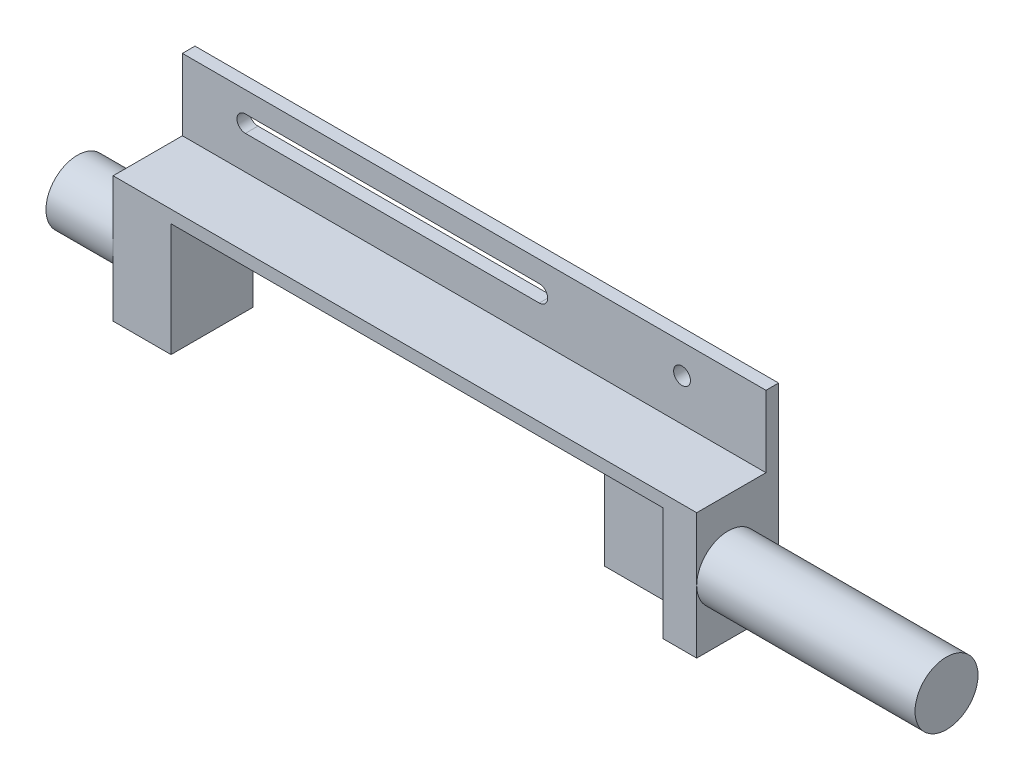
from build123d import *

# Parameters (mm, degrees)
BOSS_EXTRUDE1_DEPTH     = 139
SKETCH3_R               = 2
CUT_EXTRUDE1_DEPTH      = 153.647469681
SKETCH5_W               = 30
SKETCH5_H               = 60
BOSS_EXTRUDE2_DEPTH     = 13.7
SKETCH6_W               = 27.582278357
SKETCH6_H               = 4.25
SKETCH6_W_2             = 27.382278357
BOSS_EXTRUDE3_DEPTH     = 10
CUT_EXTRUDE3_DEPTH      = 132.062650228
CUT_EXTRUDE3_DEPTH_BACK = 132.062650228
SKETCH7_R               = 1
SKETCH4_R               = 7.5
BOSS_EXTRUDE4_DEPTH     = 52
BOSS_EXTRUDE5_START     = -155
SKETCH4_2_R             = 7.5
BOSS_EXTRUDE5_DEPTH     = 155
SKETCH8_W               = 30
SKETCH8_H               = 13.7
CUT_EXTRUDE4_DEPTH      = 18.85
SKETCH9_W               = 95.207004137
SKETCH9_H               = 27
CUT_EXTRUDE5_DEPTH      = 202.60032242
SKETCH10_W              = 139
SKETCH10_H              = 30
CUT_EXTRUDE6_DEPTH      = 16.5
CUT_EXTRUDE7_DEPTH      = 203.936541806
CUT_EXTRUDE7_DEPTH_BACK = 13.7
SKETCH11_W              = 30
SKETCH11_H              = 45.211643816
SKETCH12_W              = 139
SKETCH12_H              = 13
CUT_EXTRUDE8_DEPTH      = 202.149819786
CUT_EXTRUDE9_REACH      = 199.662
SKETCH13_R              = 2.5
SKETCH14_W              = 22
SKETCH14_H              = 27
CUT_EXTRUDE10_DEPTH     = 8


with BuildPart() as part:
    # Sketch2 → Boss-Extrude1 (new body)
    with BuildSketch(Plane(origin=(0, 0, 0), x_dir=(0, 0, -1), z_dir=(1, 0, 0))):
        Polygon((-6.75, 30), (6.75, 30), (6.75, 60), (9.75, 60), (9.75, 51.134717436), (9.75, 0), (-9.75, 0), (-9.75, 60), (-6.75, 60), align=None)
    extrude(amount=BOSS_EXTRUDE1_DEPTH)

    # Sketch3 → Cut-Extrude1 (cut, through all)
    with BuildSketch(Plane(origin=(0, 0, -9.75), x_dir=(-1, 0, 0), z_dir=(0, 0, -1))):
        with Locations((-119, 40)):
            Circle(SKETCH3_R)
        with BuildLine():
            Line((-85, 42), (-15, 42))
            ThreePointArc((-15, 42), (-13, 40), (-15, 38))
            Line((-15, 38), (-85, 38))
            ThreePointArc((-85, 38), (-87, 40), (-85, 42))
        make_face()
    extrude(amount=-CUT_EXTRUDE1_DEPTH, mode=Mode.SUBTRACT)

    # Sketch5 → Boss-Extrude2 (add)
    with BuildSketch(Plane(origin=(0, 0, -9.75), x_dir=(-1, 0, 0), z_dir=(0, 0, -1))):
        with Locations((-124, 30)):
            Rectangle(SKETCH5_W, SKETCH5_H)
    extrude(amount=BOSS_EXTRUDE2_DEPTH)

    # Sketch6 → Boss-Extrude3 (add)
    with BuildSketch(Plane(origin=(0, 0, -23.45), x_dir=(-1, 0, 0), z_dir=(0, 0, -1))):
        with Locations((-125.208860821, 20.975)):
            Rectangle(SKETCH6_W, SKETCH6_H)
        with Locations((-125.308860822, 48.775)):
            Rectangle(SKETCH6_W_2, SKETCH6_H)
    extrude(amount=BOSS_EXTRUDE3_DEPTH)

    # Sketch7 → Cut-Extrude3 (cut, two sides: drawn at the far end of the back side and taken through both)
    with BuildSketch(Plane.ZY.offset(-111.617721643).offset(-CUT_EXTRUDE3_DEPTH_BACK)):
        with Locations((-30.95, 48.78)):
            Circle(SKETCH7_R)
        with Locations((-30.95, 20.97)):
            Circle(SKETCH7_R)
    extrude(amount=CUT_EXTRUDE3_DEPTH + CUT_EXTRUDE3_DEPTH_BACK, mode=Mode.SUBTRACT)

    # Sketch4 → Boss-Extrude4 (add)
    with BuildSketch(Plane(origin=(139, 0, 0), x_dir=(0, 0, -1), z_dir=(1, 0, 0))):
        with Locations(Location((-2.25, 15, 0), (0, 0, 180))):
            Circle(SKETCH4_R)
    extrude(amount=BOSS_EXTRUDE4_DEPTH)

    # Sketch4<2> → Boss-Extrude5 (add)
    with BuildSketch(Plane(origin=(139, 0, 0), x_dir=(0, 0, -1), z_dir=(1, 0, 0)).offset(BOSS_EXTRUDE5_START)):
        with Locations(Location((-2.25, 15, 0), (0, 0, 180))):
            Circle(SKETCH4_2_R)
    extrude(amount=BOSS_EXTRUDE5_DEPTH)

    # Sketch8 → Cut-Extrude4 (cut)
    with BuildSketch(Plane.XZ):
        with Locations((124, -16.6)):
            Rectangle(SKETCH8_W, SKETCH8_H)
    extrude(amount=-CUT_EXTRUDE4_DEPTH, mode=Mode.SUBTRACT)

    # Sketch9 → Cut-Extrude5 (cut, through all)
    with BuildSketch(Plane(origin=(0, 0, -9.75), x_dir=(-1, 0, 0), z_dir=(0, 0, -1))):
        with Locations((-61.396497932, 13.5)):
            Rectangle(SKETCH9_W, SKETCH9_H)
    extrude(amount=-CUT_EXTRUDE5_DEPTH, mode=Mode.SUBTRACT)

    # Sketch10 → Cut-Extrude6 (cut)
    with BuildSketch(Plane.XY.offset(9.75)):
        with Locations((69.5, 45)):
            Rectangle(SKETCH10_W, SKETCH10_H)
    extrude(amount=-CUT_EXTRUDE6_DEPTH, mode=Mode.SUBTRACT)

    # Sketch11 → Cut-Extrude7 (cut, two sides: drawn at the far end of the back side and taken through both)
    with BuildSketch(Plane(origin=(0, 0, -23.45), x_dir=(-1, 0, 0), z_dir=(0, 0, -1)).offset(-CUT_EXTRUDE7_DEPTH_BACK)):
        with Locations((-124, 37.394178092)):
            Rectangle(SKETCH11_W, SKETCH11_H)
    extrude(amount=CUT_EXTRUDE7_DEPTH + CUT_EXTRUDE7_DEPTH_BACK, mode=Mode.SUBTRACT)

    # Sketch12 → Cut-Extrude8 (cut, through all)
    with BuildSketch(Plane(origin=(0, 0, -9.75), x_dir=(-1, 0, 0), z_dir=(0, 0, -1))):
        with Locations((-69.5, 53.5)):
            Rectangle(SKETCH12_W, SKETCH12_H)
    extrude(amount=-CUT_EXTRUDE8_DEPTH, mode=Mode.SUBTRACT)

    # Sketch13 → Cut-Extrude9 (cut, up to next)
    with BuildSketch(Plane(origin=(0, 0, -9.75), x_dir=(-1, 0, 0), z_dir=(0, 0, -1)), mode=Mode.PRIVATE) as cut_extrude9_sk1:
        with Locations((-126, 7)):
            Circle(SKETCH13_R)
    cut_extrude9_tool1 = extrude(cut_extrude9_sk1.sketch, amount=-CUT_EXTRUDE9_REACH, mode=Mode.PRIVATE) & part.part
    # Sketch13 → Cut-Extrude9 (cut, up to next)
    with BuildSketch(Plane(origin=(0, 0, -9.75), x_dir=(-1, 0, 0), z_dir=(0, 0, -1)), mode=Mode.PRIVATE) as cut_extrude9_sk2:
        with Locations((-126, 17)):
            Circle(SKETCH13_R)
    cut_extrude9_tool2 = extrude(cut_extrude9_sk2.sketch, amount=-CUT_EXTRUDE9_REACH, mode=Mode.PRIVATE) & part.part
    add(cut_extrude9_tool1.solids().sort_by_distance((126, 7, -9.75))[0], mode=Mode.SUBTRACT)
    add(cut_extrude9_tool2.solids().sort_by_distance((126, 17, -9.75))[0], mode=Mode.SUBTRACT)

    # Sketch14 → Cut-Extrude10 (cut)
    with BuildSketch(Plane.XY.offset(9.75)):
        with Locations((120, 13.5)):
            Rectangle(SKETCH14_W, SKETCH14_H)
    extrude(amount=-CUT_EXTRUDE10_DEPTH, mode=Mode.SUBTRACT)


solid = part.part
